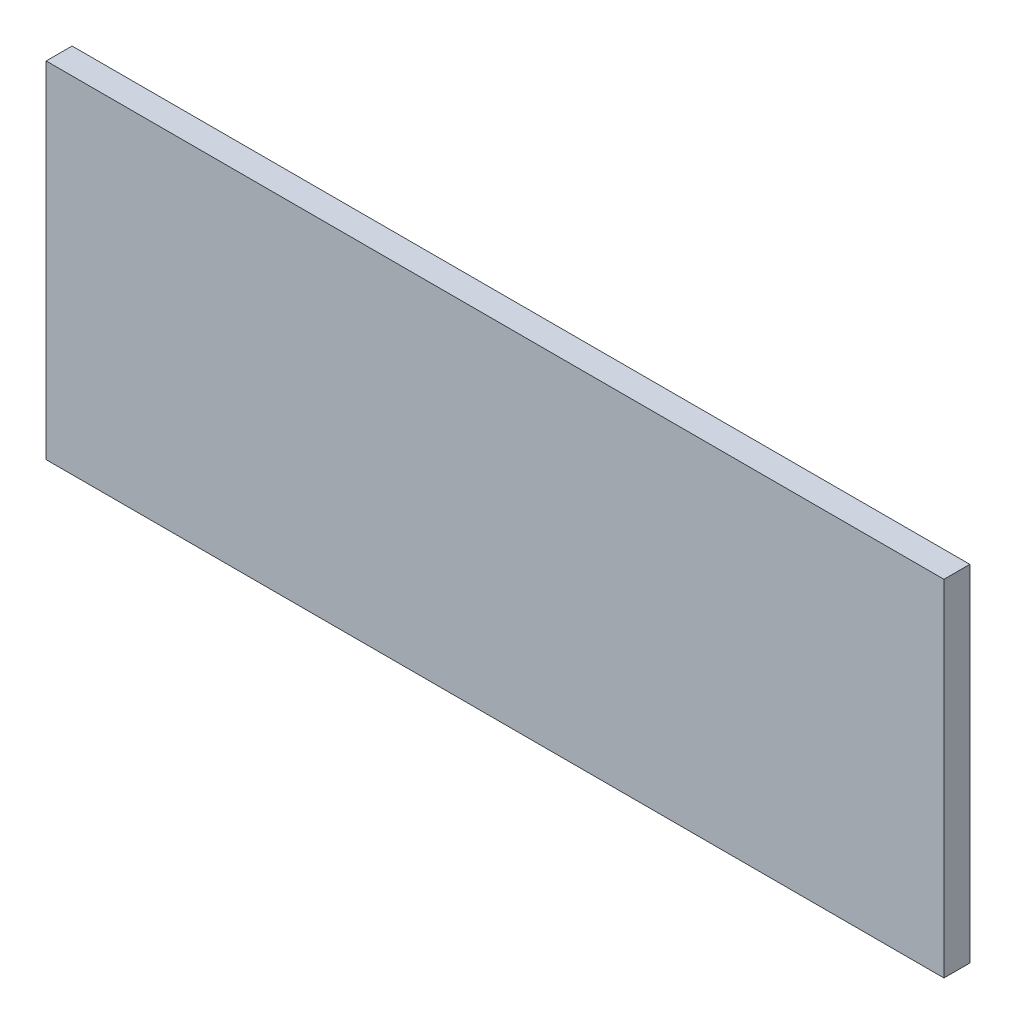
from build123d import *

# Parameters (mm, degrees)
SKETCH1_W           = 104
SKETCH1_H           = 40
BOSS_EXTRUDE1_DEPTH = 3


with BuildPart() as part:
    # Sketch1 → Boss-Extrude1 (new body)
    with BuildSketch(Plane.XY):
        with Locations((-3.88, 1.23)):
            Rectangle(SKETCH1_W, SKETCH1_H)
    extrude(amount=BOSS_EXTRUDE1_DEPTH)


solid = part.part
